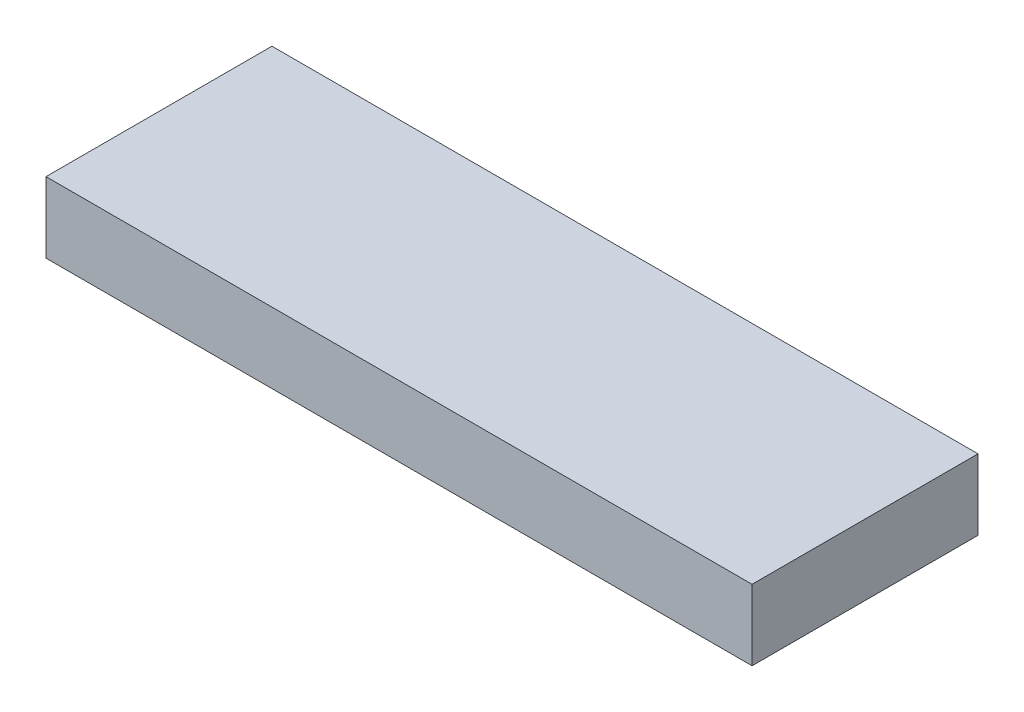
from build123d import *

# Parameters (mm, degrees)
SKETCH_1_W      = 16
SKETCH_1_H      = 5
EXTRUDE_1_DEPTH = 50


with BuildPart() as part:
    # 草图1 → 凸台-拉伸1 (new body)
    with BuildSketch(Plane(origin=(0, 0, 0), x_dir=(0, 0, -1), z_dir=(1, 0, 0))):
        Rectangle(SKETCH_1_W, SKETCH_1_H)
    extrude(amount=EXTRUDE_1_DEPTH)


solid = part.part
